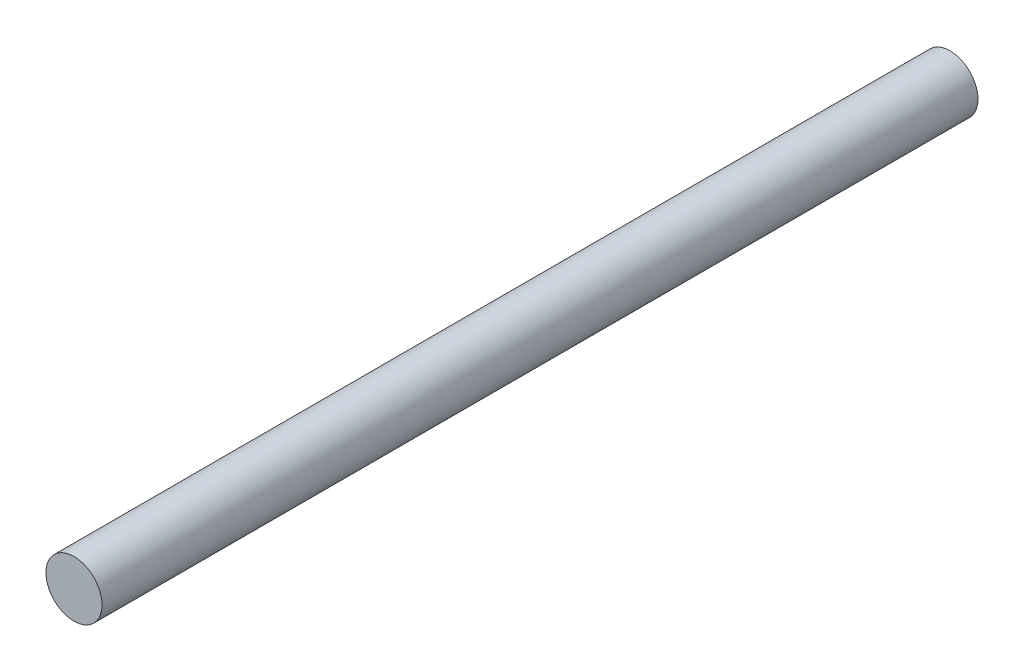
from build123d import *

# Parameters (mm, degrees)
SKETCH1_R           = 8
BOSS_EXTRUDE1_DEPTH = 250


with BuildPart() as part:
    # Sketch1 → Boss-Extrude1 (new body)
    with BuildSketch(Plane.XY):
        Circle(SKETCH1_R)
    extrude(amount=BOSS_EXTRUDE1_DEPTH)


solid = part.part
